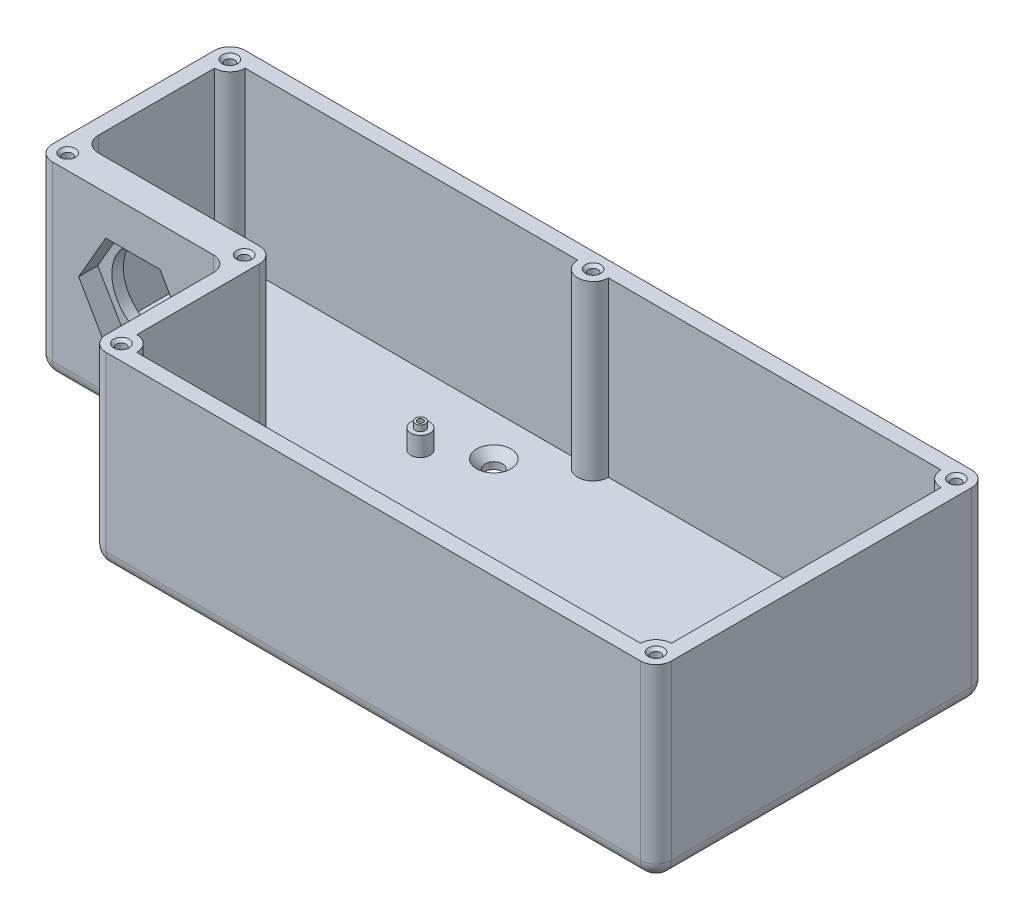
from build123d import *

# Parameters (mm, degrees)
CROQUIS2_R                                           = 1.3
SALIENTE_EXTRUIR1_DEPTH                              = 6.5
SALIENTE_EXTRUIR1_2_DEPTH                            = 6.5
SALIENTE_EXTRUIR1_3_DEPTH                            = 6.5
SALIENTE_EXTRUIR1_4_DEPTH                            = 6.5
CROQUIS3_R                                           = 2.5
SALIENTE_EXTRUIR2_DEPTH                              = 5
CROQUIS4_R                                           = 0.75
CORTAR_EXTRUIR1_DEPTH                                = 5
SALIENTE_EXTRUIR3_DEPTH                              = 4
SALIENTE_EXTRUIR4_DEPTH                              = 45
SALIENTE_EXTRUIR4_DEPTH_BACK                         = 4
REDONDEO1_R                                          = 4
CORTAR_EXTRUIR2_DEPTH                                = 5
CROQUIS8_R                                           = 10.5
CORTAR_EXTRUIR3_DEPTH                                = 5
CROQUIS9_R                                           = 4
SALIENTE_EXTRUIR6_DEPTH                              = 45
REFRENTADO_PARA_TORNILLO_TAP_N_CON_CABEZ_D           = 2.5
REFRENTADO_PARA_TORNILLO_TAP_N_CON_CABEZ_DEPTH       = 10
REFRENTADO_PARA_TORNILLO_TAP_N_CON_CABEZ_CSINK_D     = 4
REFRENTADO_PARA_TORNILLO_TAP_N_CON_CABEZ_CSINK_ANGLE = 90
REFRENTADO_PARA_TORNILLO_TAP_N_CON_CABEZ_TIP         = 0.751075774
REFRENTADO_PARA_TORNILLO_TAP_N_CON_C_2_D             = 4.5
REFRENTADO_PARA_TORNILLO_TAP_N_CON_C_2_DEPTH         = 10
REFRENTADO_PARA_TORNILLO_TAP_N_CON_C_2_CSINK_D       = 8.96
REFRENTADO_PARA_TORNILLO_TAP_N_CON_C_2_CSINK_ANGLE   = 90
REFRENTADO_PARA_TORNILLO_TAP_N_CON_C_2_TIP           = 1.351936393


with BuildPart() as part:
    # Croquis2 → Saliente-Extruir1 (new body)
    with BuildSketch(Plane(origin=(0, 0, 0), x_dir=(1, 0, 0), z_dir=(0, 1, 0))):
        with Locations(Location((3, 3, 0), (0, 0, 90))):
            Circle(CROQUIS2_R)
    extrude(amount=SALIENTE_EXTRUIR1_DEPTH)



with BuildPart() as body_2:
    # Croquis2 → Saliente-Extruir1 2 (new body)
    with BuildSketch(Plane(origin=(0, 0, 0), x_dir=(1, 0, 0), z_dir=(0, 1, 0))):
        with Locations(Location((111.3361, 3, 0), (0, 0, 90))):
            Circle(CROQUIS2_R)
    extrude(amount=SALIENTE_EXTRUIR1_2_DEPTH)


with BuildPart() as body_3:
    # Croquis2 → Saliente-Extruir1 3 (new body)
    with BuildSketch(Plane(origin=(0, 0, 0), x_dir=(1, 0, 0), z_dir=(0, 1, 0))):
        with Locations(Location((109.6374, 43.2299, 0), (0, 0, 90))):
            Circle(CROQUIS2_R)
    extrude(amount=SALIENTE_EXTRUIR1_3_DEPTH)


with BuildPart() as body_4:
    # Croquis2 → Saliente-Extruir1 4 (new body)
    with BuildSketch(Plane(origin=(0, 0, 0), x_dir=(1, 0, 0), z_dir=(0, 1, 0))):
        with Locations(Location((3, 45, 0), (0, 0, 90))):
            Circle(CROQUIS2_R)
    extrude(amount=SALIENTE_EXTRUIR1_4_DEPTH)


with BuildPart() as part_1:
    add(part.part)

    add(body_2.part)  # Saliente-Extruir2 merges body 2

    add(body_3.part)  # Saliente-Extruir2 merges body 3

    add(body_4.part)  # Saliente-Extruir2 merges body 4
    # Croquis3 → Saliente-Extruir2 (add)
    with BuildSketch(Plane(origin=(0, 0, 0), x_dir=(1, 0, 0), z_dir=(0, 1, 0))):
        with Locations(Location((3, 45, 0), (0, 0, 270))):
            Circle(CROQUIS3_R)
        with Locations(Location((3, 3, 0), (0, 0, 270))):
            Circle(CROQUIS3_R)
        with Locations(Location((111.3361, 3, 0), (0, 0, 270))):
            Circle(CROQUIS3_R)
        with Locations(Location((109.6374, 43.2299, 0), (0, 0, 270))):
            Circle(CROQUIS3_R)
    extrude(amount=SALIENTE_EXTRUIR2_DEPTH)

    # Croquis4 → Cortar-Extruir1 (cut)
    with BuildSketch(Plane(origin=(0, 6.5, 0), x_dir=(1, 0, 0), z_dir=(0, 1, 0))):
        with Locations(Location((3, 45, 0), (0, 0, 270))):
            Circle(CROQUIS4_R)
        with Locations(Location((3, 3, 0), (0, 0, 270))):
            Circle(CROQUIS4_R)
        with Locations(Location((111.3361, 3, 0), (0, 0, 270))):
            Circle(CROQUIS4_R)
        with Locations(Location((109.6374, 43.2299, 0), (0, 0, 270))):
            Circle(CROQUIS4_R)
    extrude(amount=-CORTAR_EXTRUIR1_DEPTH, mode=Mode.SUBTRACT)

    # Croquis5 → Saliente-Extruir3 (add)
    with BuildSketch(Plane(origin=(0, 0, 0), x_dir=(1, 0, 0), z_dir=(0, 1, 0))):
        Polygon((124.3681, 63.2781), (-64.9319, 63.2781), (-64.9319, 25.0181), (-14.9319, 25.0181), (-14.9319, -14.9819), (124.3681, -14.9819), align=None)
    extrude(amount=-SALIENTE_EXTRUIR3_DEPTH)

    # Croquis6 → Saliente-Extruir4 (add, two sides: drawn at the far end of the back side and taken through both)
    with BuildSketch(Plane(origin=(0, 0, 0), x_dir=(1, 0, 0), z_dir=(0, 1, 0)).offset(-SALIENTE_EXTRUIR4_DEPTH_BACK)):
        Polygon((-68.9319, 21.0181), (-68.9319, 17.0181), (-18.9319, 17.0181), (-18.9319, -18.9819), (128.3681, -18.9819), (128.3681, 67.2781), (-68.9319, 67.2781), align=None)
        Polygon((-14.9319, -14.9819), (124.3681, -14.9819), (124.3681, 63.2781), (-64.9319, 63.2781), (-64.9319, 25.0181), (-14.9319, 25.0181), align=None, mode=Mode.SUBTRACT)
    extrude(amount=SALIENTE_EXTRUIR4_DEPTH + SALIENTE_EXTRUIR4_DEPTH_BACK)

    # Redondeo1
    redondeo1_edges = [part_1.edges().sort_by_distance(p)[0] for p in [
        (-14.9319, 22.5, -25.0181),
        (-64.9319, 22.5, -25.0181),
        (-64.9319, 22.5, -63.2781),
        (124.3681, 22.5, -63.2781),
        (124.3681, 22.5, 14.9819),
        (-14.9319, 22.5, 14.9819),
        (-18.9319, 20.5, -17.0181),
        (-43.9319, -4, -17.0181),
        (-68.9319, 20.5, -17.0181),
        (-68.9319, -4, -42.1481),
        (-68.9319, 20.5, -67.2781),
        (29.7181, -4, -67.2781),
        (128.3681, 20.5, -67.2781),
        (128.3681, -4, -24.1481),
        (128.3681, 20.5, 18.9819),
        (54.7181, -4, 18.9819),
        (-18.9319, 20.5, 18.9819),
        (-18.9319, -4, 0.9819),
    ]]
    fillet(redondeo1_edges, radius=REDONDEO1_R)

    # Croquis7 → Cortar-Extruir2 (cut)
    with BuildSketch(Plane.XY.offset(-17.0181)):
        Polygon((-58.076981595, 22.5), (-51.004440798, 10.25), (-36.859359202, 10.25), (-29.786818405, 22.5), (-36.859359202, 34.75), (-51.004440798, 34.75), align=None)
    extrude(amount=-CORTAR_EXTRUIR2_DEPTH, mode=Mode.SUBTRACT)

    # Croquis8 → Cortar-Extruir3 (cut)
    with BuildSketch(Plane.XY.offset(-22.0181)):
        with Locations((-43.9319, 22.5)):
            Circle(CROQUIS8_R)
    extrude(amount=-CORTAR_EXTRUIR3_DEPTH, mode=Mode.SUBTRACT)

    # Croquis9 → Saliente-Extruir6 (add)
    with BuildSketch(Plane(origin=(0, 45, 0), x_dir=(1, 0, 0), z_dir=(0, 1, 0))):
        with Locations((-64.9319, 63.2781)):
            Circle(CROQUIS9_R)
        with Locations((124.3681, 63.2781)):
            Circle(CROQUIS9_R)
        with Locations((124.3681, -14.9819)):
            Circle(CROQUIS9_R)
        with Locations((-64.9319, 21.0181)):
            Circle(CROQUIS9_R)
        with Locations((-18.9319, 21.0181)):
            Circle(CROQUIS9_R)
        with Locations((-14.9319, -14.9819)):
            Circle(CROQUIS9_R)
        with Locations((29.7181, 63.2781)):
            Circle(CROQUIS9_R)
    extrude(amount=-SALIENTE_EXTRUIR6_DEPTH)

    # Refrentado para tornillo tap_n con cabez
    with Locations(Plane(origin=(0, 45, 0), x_dir=(1, 0, 0), z_dir=(0, 1, 0))):
        with Locations((-64.9319, 21.0181), (-64.9319, 63.2781), (29.7181, 63.2781), (124.3681, 63.2781), (124.3681, -14.9819), (-14.9319, -14.9819), (-18.9319, 21.0181)):
            CounterSinkHole(REFRENTADO_PARA_TORNILLO_TAP_N_CON_CABEZ_D / 2, REFRENTADO_PARA_TORNILLO_TAP_N_CON_CABEZ_CSINK_D / 2, depth=REFRENTADO_PARA_TORNILLO_TAP_N_CON_CABEZ_DEPTH, counter_sink_angle=REFRENTADO_PARA_TORNILLO_TAP_N_CON_CABEZ_CSINK_ANGLE)
            with Locations((0, 0, -(REFRENTADO_PARA_TORNILLO_TAP_N_CON_CABEZ_DEPTH + REFRENTADO_PARA_TORNILLO_TAP_N_CON_CABEZ_TIP / 2))):  # 118° drill point
                Cone(0, REFRENTADO_PARA_TORNILLO_TAP_N_CON_CABEZ_D / 2, REFRENTADO_PARA_TORNILLO_TAP_N_CON_CABEZ_TIP, mode=Mode.SUBTRACT)

    # Refrentado para tornillo tap_n con c 2
    with Locations(Plane(origin=(0, 0, 0), x_dir=(1, 0, 0), z_dir=(0, 1, 0))):
        with Locations((14.6331, 52.5081), (94.8031, 52.5081), (94.8031, -4.2119), (14.6331, -4.2119)):
            CounterSinkHole(REFRENTADO_PARA_TORNILLO_TAP_N_CON_C_2_D / 2, REFRENTADO_PARA_TORNILLO_TAP_N_CON_C_2_CSINK_D / 2, depth=REFRENTADO_PARA_TORNILLO_TAP_N_CON_C_2_DEPTH, counter_sink_angle=REFRENTADO_PARA_TORNILLO_TAP_N_CON_C_2_CSINK_ANGLE)
            with Locations((0, 0, -(REFRENTADO_PARA_TORNILLO_TAP_N_CON_C_2_DEPTH + REFRENTADO_PARA_TORNILLO_TAP_N_CON_C_2_TIP / 2))):  # 118° drill point
                Cone(0, REFRENTADO_PARA_TORNILLO_TAP_N_CON_C_2_D / 2, REFRENTADO_PARA_TORNILLO_TAP_N_CON_C_2_TIP, mode=Mode.SUBTRACT)


solid = part_1.part
